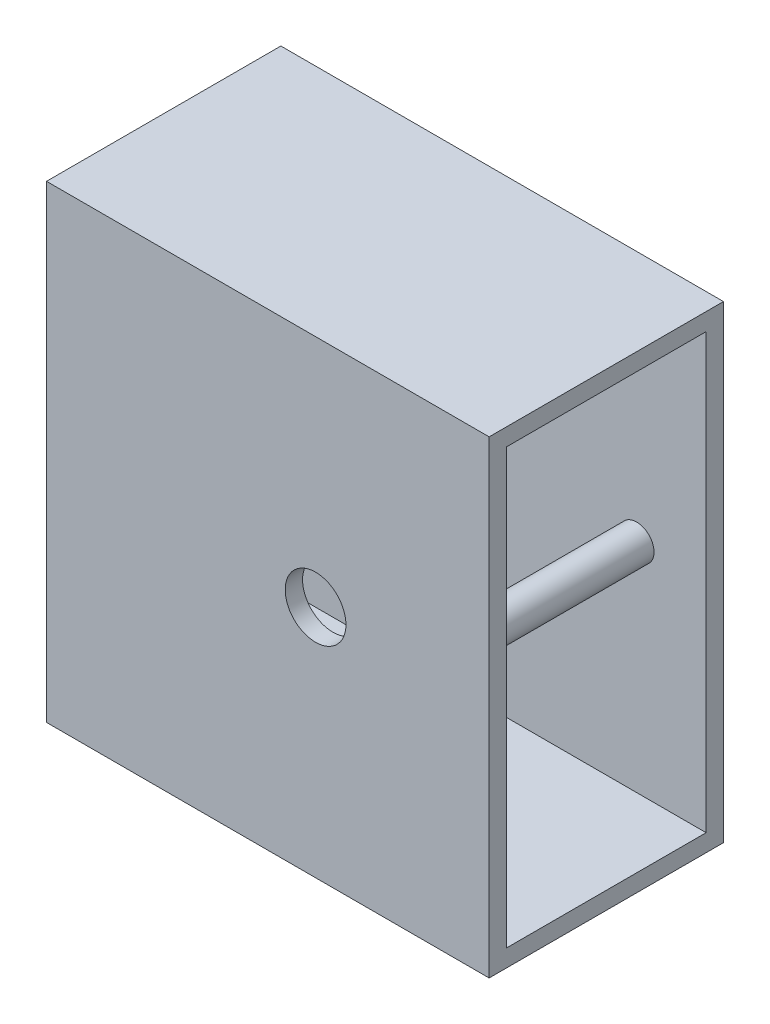
from build123d import *

# Parameters (mm, degrees)
SKETCH_1_W          = 27
SKETCH_1_H          = 54
SKETCH_1_W_2        = 23
SKETCH_1_H_2        = 50
EXTRUDE_1_DEPTH     = 50
SKETCH_2_R          = 3.5
CUT_EXTRUDE_1_DEPTH = 5
SKETCH_3_R          = 2
EXTRUDE_2_DEPTH     = 25
SKETCH_4_W          = 27
SKETCH_4_H          = 54
EXTRUDE_3_DEPTH     = 1


with BuildPart() as part:
    # 草图1 → 凸台-拉伸1 (new body)
    with BuildSketch(Plane(origin=(0, 0, 0), x_dir=(0, 0, -1), z_dir=(1, 0, 0))):
        Rectangle(SKETCH_1_W, SKETCH_1_H)
        Rectangle(SKETCH_1_W_2, SKETCH_1_H_2, mode=Mode.SUBTRACT)
    extrude(amount=EXTRUDE_1_DEPTH)

    # 草图2 → 切除-拉伸1 (cut)
    with BuildSketch(Plane.XY.offset(13.5)):
        with Locations((30, 0)):
            Circle(SKETCH_2_R)
    extrude(amount=-CUT_EXTRUDE_1_DEPTH, mode=Mode.SUBTRACT)

    # 草图3 → 凸台-拉伸2 (add)
    with BuildSketch(Plane.XY.offset(13.5)):
        with Locations((42, 0)):
            Circle(SKETCH_3_R)
    extrude(amount=-EXTRUDE_2_DEPTH)

    # 草图4 → 凸台-拉伸3 (add)
    with BuildSketch(Plane.ZY):
        Rectangle(SKETCH_4_W, SKETCH_4_H)
    extrude(amount=EXTRUDE_3_DEPTH)


solid = part.part
